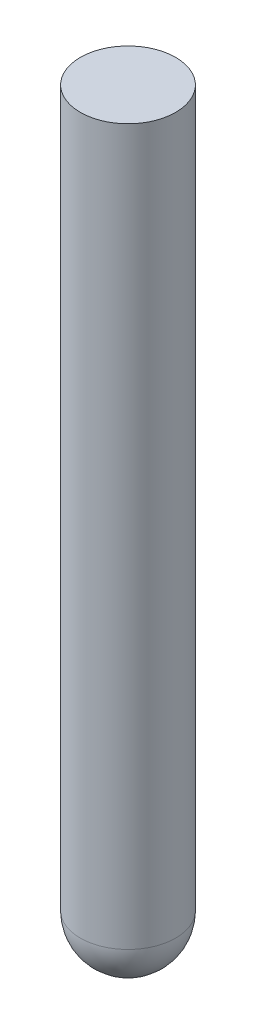
from build123d import *

# Parameters (mm, degrees)
SKETCH1_R           = 3.175
BOSS_EXTRUDE1_DEPTH = 50.8
FILLET1_R           = 3.175


with BuildPart() as part:
    # Sketch1 → Boss-Extrude1 (new body)
    with BuildSketch(Plane(origin=(0, 0, 0), x_dir=(1, 0, 0), z_dir=(0, 1, 0))):
        with Locations(Location((0, 0, 0), (0, 0, 270))):
            Circle(SKETCH1_R)
    extrude(amount=BOSS_EXTRUDE1_DEPTH)

    # Fillet1
    fillet1_edges = [part.edges().sort_by_distance(p)[0] for p in [
        (0, 0, -3.175),
    ]]
    fillet(fillet1_edges, radius=FILLET1_R)


solid = part.part
